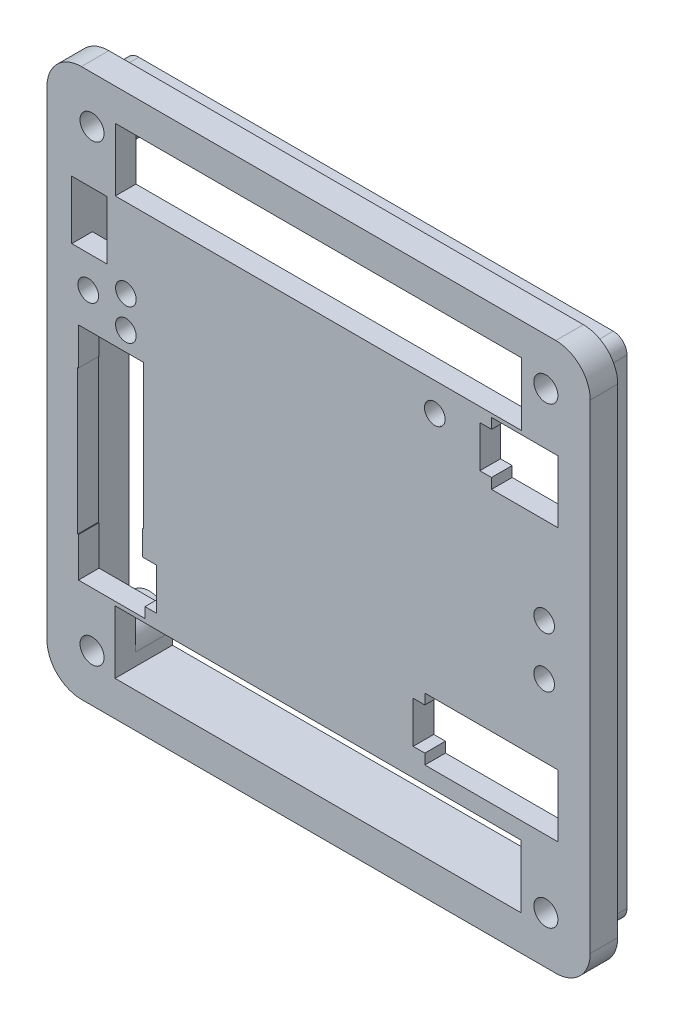
from build123d import *
from build123d.topology import SkipClean

# Parameters (mm, degrees)
SKETCH1_W               = 59.06
SKETCH1_H               = 9.45
SKETCH1_R               = 1.75
SKETCH1_R_2             = 1.1
BOSS_EXTRUDE1_DEPTH     = 3
BOSS_EXTRUDE2_START     = 6.15
SKETCH2_R               = 1.75
BOSS_EXTRUDE2_DEPTH     = 6.15
SKETCH4_W               = 177.250656685
SKETCH4_H               = 178.995431185
CUT_EXTRUDE2_DEPTH      = 5.15
CUT_EXTRUDE3_DEPTH      = 242.046411506
CUT_EXTRUDE3_DEPTH_BACK = 242.046411506
SKETCH6_W               = 0.5
SKETCH6_H               = 8.16631948
SKETCH6_H_2             = 8.46
CUT_EXTRUDE4_DEPTH      = 242.046411506
SKETCH8_W               = 8.2
SKETCH8_H               = 9.06
SKETCH8_W_2             = 17.9
SKETCH8_W_3             = 8.173219028
SKETCH8_H_2             = 9.620189514
CUT_EXTRUDE5_DEPTH      = 242.046411506
SKETCH9_W               = 59.06
SKETCH9_H               = 0.15
BOSS_EXTRUDE3_DEPTH     = 9.15
SKETCH9_3_W             = 59.06
SKETCH9_3_H             = 0.15
BOSS_EXTRUDE4_DEPTH     = 3
SKETCH10_R              = 1.5
CUT_EXTRUDE6_DEPTH      = 241.951182815
CUT_EXTRUDE7_DEPTH      = 217.345909367
CUT_EXTRUDE7_DEPTH_BACK = 217.345909367
SKETCH11_W              = 73
SKETCH11_H              = 0.8
CUT_EXTRUDE8_DEPTH      = 10
SKETCH13_W              = 1.5
SKETCH13_H              = 9.06
SKETCH13_H_2            = 7.56
CUT_EXTRUDE9_DEPTH      = 10


with BuildPart() as part:
    # Sketch1 → Boss-Extrude1 (new body)
    with BuildSketch(Plane.XY):
        with BuildLine():
            ThreePointArc((197.2, -130.9), (200.735533906, -129.435533906), (202.2, -125.9))
            Line((202.2, -125.9), (202.2, -56.2))
            ThreePointArc((202.2, -56.2), (200.735533906, -52.664466094), (197.2, -51.2))
            Line((197.2, -51.2), (128.2, -51.2))
            ThreePointArc((128.2, -51.2), (124.664466094, -52.664466094), (123.2, -56.2))
            Line((123.2, -56.2), (123.2, -125.9))
            ThreePointArc((123.2, -125.9), (124.664466094, -129.435533906), (128.2, -130.9))
            Line((128.2, -130.9), (197.2, -130.9))
        make_face()
        Polygon((127.665152647, -110.350853926), (127.665152647, -89.390853926), (137.115152647, -89.390853926), (137.115152647, -108.5275), (139.15, -108.5275), (139.15, -114.5875), (135.15, -114.5875), (135.15, -115.7875), (128.05, -115.7875), (128.05, -110.350853926), align=None, mode=Mode.SUBTRACT)
        with Locations((162.625, -121.23)):
            Rectangle(SKETCH1_W, SKETCH1_H, mode=Mode.SUBTRACT)
        with Locations((129.75, -124)):
            Circle(SKETCH1_R, mode=Mode.SUBTRACT)
        with Locations((195.75, -124)):
            Circle(SKETCH1_R, mode=Mode.SUBTRACT)
        with Locations((129.2, -78.870001)):
            Circle(SKETCH1_R_2, mode=Mode.SUBTRACT)
        Polygon((126.8, -74.2), (126.8, -65.7), (131.9, -65.7), (131.9, -66.7), (131.95, -66.7), (131.95, -67.8), (131.9, -67.8), (131.9, -74.2), align=None, mode=Mode.SUBTRACT)
        with Locations((129.75, -58)):
            Circle(SKETCH1_R, mode=Mode.SUBTRACT)
        with Locations((162.662, -60.458)):
            Rectangle(SKETCH1_W, SKETCH1_H, mode=Mode.SUBTRACT)
        Polygon((197.25, -113.8875), (180.45, -113.8875), (180.45, -112.6875), (176.45, -112.6875), (176.45, -106.6275), (180.45, -106.6275), (180.45, -105.4275), (197.25, -105.4275), align=None, mode=Mode.SUBTRACT)
        with Locations((195.5, -94.675001)):
            Circle(SKETCH1_R_2, mode=Mode.SUBTRACT)
        with Locations((195.5, -87.325001)):
            Circle(SKETCH1_R_2, mode=Mode.SUBTRACT)
        Polygon((186.15, -67.0655), (190.15, -67.0655), (190.15, -65.8655), (197.25, -65.8655), (197.25, -74.3255), (190.15, -74.3255), (190.15, -73.1255), (186.15, -73.1255), align=None, mode=Mode.SUBTRACT)
        with Locations((195.75, -58)):
            Circle(SKETCH1_R, mode=Mode.SUBTRACT)
    extrude(amount=BOSS_EXTRUDE1_DEPTH)

    # Sketch2 → Boss-Extrude2 (add)
    with SkipClean():  # the faces are left unmerged after this step: merging them gives an invalid solid
        with BuildSketch(Plane(origin=(0, 0, 0), x_dir=(-1, 0, 0), z_dir=(0, 0, -1)).offset(BOSS_EXTRUDE2_START)):
            with BuildLine():
                Line((-123.2, -125.9), (-123.2, -116.505))
                Line((-123.2, -116.505), (-123.2, -65.183))
                Line((-123.2, -65.183), (-123.2, -56.2))
                ThreePointArc((-123.2, -56.2), (-124.664466094, -52.664466094), (-128.2, -51.2))
                Line((-128.2, -51.2), (-133.132, -51.2))
                Line((-133.132, -51.2), (-192.192, -51.2))
                Line((-192.192, -51.2), (-197.2, -51.2))
                ThreePointArc((-197.2, -51.2), (-200.735533906, -52.664466094), (-202.2, -56.2))
                Line((-202.2, -56.2), (-202.2, -65.183))
                Line((-202.2, -65.183), (-202.2, -116.505))
                Line((-202.2, -116.505), (-202.2, -125.9))
                ThreePointArc((-202.2, -125.9), (-200.735533906, -129.435533906), (-197.2, -130.9))
                Line((-197.2, -130.9), (-192.155, -130.9))
                Line((-192.155, -130.9), (-133.095, -130.9))
                Line((-133.095, -130.9), (-128.2, -130.9))
                ThreePointArc((-128.2, -130.9), (-124.664466094, -129.435533906), (-123.2, -125.9))
            make_face()
            with Locations((-195.75, -58)):
                Circle(SKETCH2_R, mode=Mode.SUBTRACT)
            with Locations((-129.75, -58)):
                Circle(SKETCH2_R, mode=Mode.SUBTRACT)
            with Locations((-129.75, -124)):
                Circle(SKETCH2_R, mode=Mode.SUBTRACT)
            with Locations((-195.75, -124)):
                Circle(SKETCH2_R, mode=Mode.SUBTRACT)
            with BuildLine():
                Line((-192.192, -58), (-192.192, -55.733))
                Line((-192.192, -55.733), (-133.132, -55.733))
                Line((-133.132, -55.733), (-133.132, -58))
                ThreePointArc((-133.132, -58), (-130.604699947, -61.272218208), (-126.8, -59.653911727))
                Line((-126.8, -59.653911727), (-126.8, -122.423128097))
                ThreePointArc((-126.8, -122.423128097), (-130.5627961, -120.755252321), (-133.095, -124))
                Line((-133.095, -124), (-133.095, -125.955))
                Line((-133.095, -125.955), (-192.155, -125.955))
                Line((-192.155, -125.955), (-192.155, -124))
                ThreePointArc((-192.155, -124), (-193.809442735, -120.973737867), (-197.25, -120.73288736))
                Line((-197.25, -120.73288736), (-197.25, -61.226354599))
                ThreePointArc((-197.25, -61.226354599), (-193.836578457, -60.999696985), (-192.192, -58))
            make_face(mode=Mode.SUBTRACT)
            with BuildLine():
                Line((-127.035778196, -125.955), (-126.8, -125.955))
                Line((-126.8, -125.955), (-126.8, -125.576871903))
                ThreePointArc((-126.8, -125.576871903), (-126.911585412, -125.769866556), (-127.035778196, -125.955))
            make_face(mode=Mode.SUBTRACT)
        extrude(amount=-BOSS_EXTRUDE2_DEPTH)

    # Sketch4 → Cut-Extrude2 (cut)
    with SkipClean():  # the faces are left unmerged after this step: merging them gives an invalid solid
        with BuildSketch(Plane.XY.offset(-6.15)):
            with Locations((185.170476037, -91.450590379)):
                Rectangle(SKETCH4_W, SKETCH4_H)
            with BuildLine():
                Line((126.2, -56.2), (126.2, -125.9))
                ThreePointArc((126.2, -125.9), (126.785786438, -127.314213562), (128.2, -127.9))
                Line((128.2, -127.9), (197.2, -127.9))
                ThreePointArc((197.2, -127.9), (198.614213562, -127.314213562), (199.2, -125.9))
                Line((199.2, -125.9), (199.2, -56.2))
                ThreePointArc((199.2, -56.2), (198.614213562, -54.785786438), (197.2, -54.2))
                Line((197.2, -54.2), (128.2, -54.2))
                ThreePointArc((128.2, -54.2), (126.785786438, -54.785786438), (126.2, -56.2))
            make_face(mode=Mode.SUBTRACT)
        extrude(amount=CUT_EXTRUDE2_DEPTH, mode=Mode.SUBTRACT)

    # Sketch5 → Cut-Extrude3 (cut, two sides: drawn at the far end of the back side and taken through both)
    with SkipClean():  # the faces are left unmerged after this step: merging them gives an invalid solid
        with BuildSketch(Plane.XY.offset(3).offset(-CUT_EXTRUDE3_DEPTH_BACK)):
            Polygon((127.76, -92.17), (127.76, -96.67), (127.76, -104.9), (137.21, -104.9), (137.21, -83.94), (127.76, -83.94), align=None)
        extrude(amount=CUT_EXTRUDE3_DEPTH + CUT_EXTRUDE3_DEPTH_BACK, mode=Mode.SUBTRACT)

    # Sketch6 → Cut-Extrude4 (cut, through all)
    with SkipClean():  # the faces are left unmerged after this step: merging them gives an invalid solid
        with BuildSketch(Plane.XY.offset(3)):
            with Locations((135.4, -111.70434026)):
                Rectangle(SKETCH6_W, SKETCH6_H)
            with Locations((180.2, -109.6575)):
                Rectangle(SKETCH6_W, SKETCH6_H_2)
            with Locations((189.9, -70.0955)):
                Rectangle(SKETCH6_W, SKETCH6_H_2)
        extrude(amount=-CUT_EXTRUDE4_DEPTH, mode=Mode.SUBTRACT)

    # Sketch8 → Cut-Extrude5 (cut, through all)
    with SkipClean():  # the faces are left unmerged after this step: merging them gives an invalid solid
        with BuildSketch(Plane.XY.offset(3)):
            with Locations((193.45, -70.0955)):
                Rectangle(SKETCH8_W, SKETCH8_H)
            with Locations((188.6, -109.6575)):
                Rectangle(SKETCH8_W_2, SKETCH8_H)
            with Locations((131.863390486, -111.277405243)):
                Rectangle(SKETCH8_W_3, SKETCH8_H_2)
        extrude(amount=-CUT_EXTRUDE5_DEPTH, mode=Mode.SUBTRACT)

    # Sketch9 → Boss-Extrude3 (add)
    with SkipClean():  # the faces are left unmerged after this step: merging them gives an invalid solid
        with BuildSketch(Plane.XY.offset(3)):
            with Locations((162.662, -55.808)):
                Rectangle(SKETCH9_W, SKETCH9_H)
            with Locations((162.625, -125.88)):
                Rectangle(SKETCH9_W, SKETCH9_H)
        extrude(amount=-BOSS_EXTRUDE3_DEPTH)

    # Sketch9<3> → Boss-Extrude4 (add)
    with SkipClean():  # the faces are left unmerged after this step: merging them gives an invalid solid
        with BuildSketch(Plane.XY.offset(3)):
            with Locations((162.662, -65.108)):
                Rectangle(SKETCH9_3_W, SKETCH9_3_H)
            with Locations((162.625, -116.58)):
                Rectangle(SKETCH9_3_W, SKETCH9_3_H)
        extrude(amount=-BOSS_EXTRUDE4_DEPTH)

    # Sketch10 → Cut-Extrude6 (cut, through all)
    with SkipClean():  # the faces are left unmerged after this step: merging them gives an invalid solid
        with BuildSketch(Plane(origin=(0, 0, 0), x_dir=(-1, 0, 0), z_dir=(0, 0, -1))):
            with Locations((-195.5, -94.675001)):
                Circle(SKETCH10_R)
            with Locations((-195.5, -87.325001)):
                Circle(SKETCH10_R)
            with Locations((-129.2, -78.870001)):
                Circle(SKETCH10_R)
        extrude(amount=-CUT_EXTRUDE6_DEPTH, mode=Mode.SUBTRACT)

    # Sketch11 → Cut-Extrude7 (cut, two sides: drawn at the far end of the back side and taken through both)
    with SkipClean():  # the faces are left unmerged after this step: merging them gives an invalid solid
        with BuildSketch(Plane(origin=(0, -54.2, 0), x_dir=(1, 0, 0), z_dir=(0, 1, 0)).offset(-CUT_EXTRUDE7_DEPTH_BACK)):
            with Locations((162.7, 5.75)):
                Rectangle(SKETCH11_W, SKETCH11_H)
        extrude(amount=CUT_EXTRUDE7_DEPTH + CUT_EXTRUDE7_DEPTH_BACK, mode=Mode.SUBTRACT)

    # Sketch12 → Cut-Extrude8 (cut)
    with SkipClean():  # the faces are left unmerged after this step: merging them gives an invalid solid
        with BuildSketch(Plane.XY.offset(3)):
            with BuildLine():
                add(Edge.make_bspline(
                    [(181.1, -69.2), (181.1, -69.003650459), (181.060959015, -68.807378173), (180.910679583, -68.444571529), (180.799500264, -68.27817992), (180.52182008, -68.000499736), (180.355428471, -67.889320417), (179.992621827, -67.739040985), (179.796349541, -67.7), (179.403650459, -67.7), (179.207378173, -67.739040985), (178.844571529, -67.889320417), (178.67817992, -68.000499736), (178.400499736, -68.27817992), (178.289320417, -68.444571529), (178.139040985, -68.807378173), (178.1, -69.003650459), (178.1, -69.396349541), (178.139040985, -69.592621827), (178.289320417, -69.955428471), (178.400499736, -70.12182008), (178.67817992, -70.399500264), (178.844571529, -70.510679583), (179.207378173, -70.660959015), (179.403650459, -70.7), (179.796349541, -70.7), (179.992621827, -70.660959015), (180.355428471, -70.510679583), (180.52182008, -70.399500264), (180.799500264, -70.12182008), (180.910679583, -69.955428471), (181.060959015, -69.592621827), (181.1, -69.396349541), (181.1, -69.2)],
                    knots=[0, 0, 0, 0, 0.0625, 0.0625, 0.125, 0.125, 0.1875, 0.1875, 0.25, 0.25, 0.3125, 0.3125, 0.375, 0.375, 0.4375, 0.4375, 0.5, 0.5, 0.5625, 0.5625, 0.625, 0.625, 0.6875, 0.6875, 0.75, 0.75, 0.8125, 0.8125, 0.875, 0.875, 0.9375, 0.9375, 1, 1, 1, 1], degree=3))
            make_face()
            with BuildLine():
                ThreePointArc((133.17, -81.17), (134.67, -82.67), (136.17, -81.17))
                ThreePointArc((136.17, -81.17), (134.67, -79.67), (133.17, -81.17))
            make_face()
            with BuildLine():
                ThreePointArc((136.17, -76.569999992), (134.669999996, -75.07), (133.17, -76.57))
                ThreePointArc((133.17, -76.57), (134.670000004, -78.07), (136.17, -76.569999992))
            make_face()
        extrude(amount=-CUT_EXTRUDE8_DEPTH, mode=Mode.SUBTRACT)

    # Sketch13 → Cut-Extrude9 (cut)
    with SkipClean():  # the faces are left unmerged after this step: merging them gives an invalid solid
        with BuildSketch(Plane.XY.offset(3)):
            with Locations((188.6, -70.0955)):
                Rectangle(SKETCH13_W, SKETCH13_H)
            with Locations((136.7, -112.3075)):
                Rectangle(SKETCH13_W, SKETCH13_H_2)
            with Locations((178.9, -109.6575)):
                Rectangle(SKETCH13_W, SKETCH13_H)
        extrude(amount=-CUT_EXTRUDE9_DEPTH, mode=Mode.SUBTRACT)


solid = part.part
